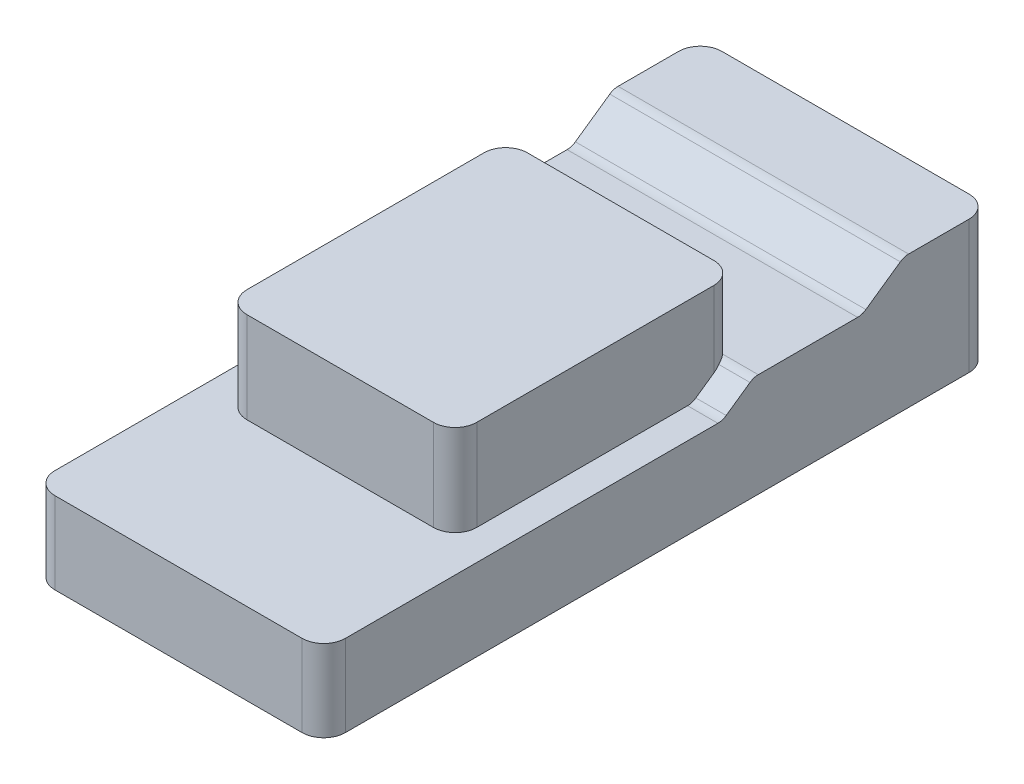
from build123d import *

# Parameters (mm, degrees)
BOSS_EXTRUDE1_DEPTH = 40.2
SKETCH2_W           = 31.8
SKETCH2_H           = 38.8
BOSS_EXTRUDE2_DEPTH = 12.6
FILLET1_R           = 3
FILLET2_R           = 3
FILLET3_R           = 2


with BuildPart() as part:
    # Sketch1 → Boss-Extrude1 (new body)
    with BuildSketch(Plane(origin=(0, 0, 0), x_dir=(0, 0, -1), z_dir=(1, 0, 0))):
        Polygon((46.15, 0), (-46.15, 0), (-46.15, 11.3), (9.024430632, 11.3), (13.351719093, 14.33), (28.351719093, 14.33), (34.15, 18.39), (46.15, 18.39), align=None)
    extrude(amount=-BOSS_EXTRUDE1_DEPTH)

    # Sketch2 → Boss-Extrude2 (add)
    with BuildSketch(Plane(origin=(0, 11.3, 0), x_dir=(1, 0, 0), z_dir=(0, 1, 0))):
        with Locations((-20.1, -4.375569368)):
            Rectangle(SKETCH2_W, SKETCH2_H)
    extrude(amount=BOSS_EXTRUDE2_DEPTH)

    # Fillet1
    fillet1_edges = [part.edges().sort_by_distance(p)[0] for p in [
        (-36, 19.115, -15.024430632),
        (-4.2, 19.115, -15.024430632),
        (-36, 17.6, 23.775569368),
        (-4.2, 17.6, 23.775569368),
    ]]
    fillet(fillet1_edges, radius=FILLET1_R)

    # Fillet2
    fillet2_edges = [part.edges().sort_by_distance(p)[0] for p in [
        (0, 9.195, -46.15),
        (0, 5.65, 46.15),
        (-40.2, 9.195, -46.15),
        (-40.2, 5.65, 46.15),
    ]]
    fillet(fillet2_edges, radius=FILLET2_R)

    # Fillet3
    fillet3_edges = [part.edges().sort_by_distance(p)[0] for p in [
        (-38.1, 11.3, -9.024430632),
        (-2.1, 11.3, -9.024430632),
        (-37.945204942, 14.33, -13.351719093),
        (-2.254795058, 14.33, -13.351719093),
        (-20.1, 14.33, -28.351719093),
        (-20.1, 18.39, -34.15),
    ]]
    fillet(fillet3_edges, radius=FILLET3_R)


solid = part.part
